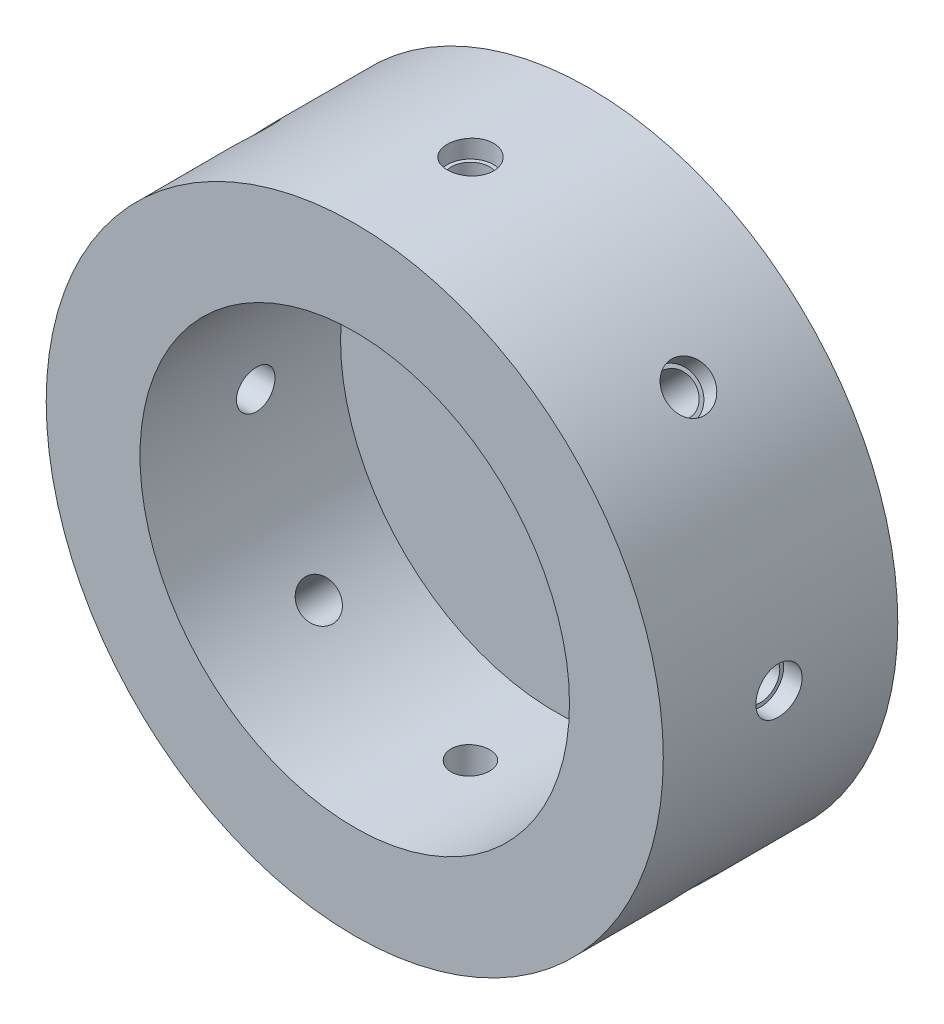
from build123d import *

# Parameters (mm, degrees)
SKETCH2_R                = 100
SKETCH2_R_2              = 69.6
BOSS_EXTRUDE1_DEPTH      = 75
BOSS_EXTRUDE2_DEPTH      = 1
BOSS_EXTRUDE2_DEPTH_BACK = 10
SKETCH3_R                = 100
SKETCH3_R_2              = 10
SKETCH4_R                = 7.5
CUT_EXTRUDE4_DEPTH       = 6
SKETCH7_R                = 6.25
CUT_EXTRUDE5_DEPTH       = 50
CIRPATTERN1_COUNT        = 8


with BuildPart() as part:
    # Sketch2 → Boss-Extrude1 (new body)
    with BuildSketch(Plane.XY):
        Circle(SKETCH2_R)
        Circle(SKETCH2_R_2, mode=Mode.SUBTRACT)
    extrude(amount=-BOSS_EXTRUDE1_DEPTH)

    # Sketch3 → Boss-Extrude2 (add, two sides: drawn at the far end of the back side and taken through both)
    with BuildSketch(Plane(origin=(0, 0, -75), x_dir=(-1, 0, 0), z_dir=(0, 0, -1)).offset(-BOSS_EXTRUDE2_DEPTH_BACK)):
        with Locations(Location((0, 0, 0), (0, 0, 180))):
            Circle(SKETCH3_R)
        Circle(SKETCH3_R_2, mode=Mode.SUBTRACT)
    extrude(amount=BOSS_EXTRUDE2_DEPTH + BOSS_EXTRUDE2_DEPTH_BACK)

    # Sketch4 → Cut-Extrude4 (cut)
    with BuildSketch(Plane(origin=(0, -100, 0), x_dir=(1, 0, 0), z_dir=(0, 1, 0))):
        with Locations(Location((0, 37.5, 0), (0, 0, 90))):
            Circle(SKETCH4_R)
    cut_extrude4 = extrude(amount=CUT_EXTRUDE4_DEPTH, mode=Mode.SUBTRACT)

    # Sketch7 → Cut-Extrude5 (cut)
    with BuildSketch(Plane.XZ.offset(94)):
        with Locations(Location((0, -37.5, 0), (0, 0, 270))):
            Circle(SKETCH7_R)
    cut_extrude5 = extrude(amount=-CUT_EXTRUDE5_DEPTH, mode=Mode.SUBTRACT)

    # CirPattern1: Cut-Extrude4, Cut-Extrude5 ×8 about axis
    cirpattern1_axis = Axis((0, 0, 0), (0, 0, 1))
    add([cut_extrude4.rotate(cirpattern1_axis, i * 360 / CIRPATTERN1_COUNT) for i in range(1, CIRPATTERN1_COUNT)], mode=Mode.SUBTRACT)
    add([cut_extrude5.rotate(cirpattern1_axis, i * 360 / CIRPATTERN1_COUNT) for i in range(1, CIRPATTERN1_COUNT)], mode=Mode.SUBTRACT)


solid = part.part
